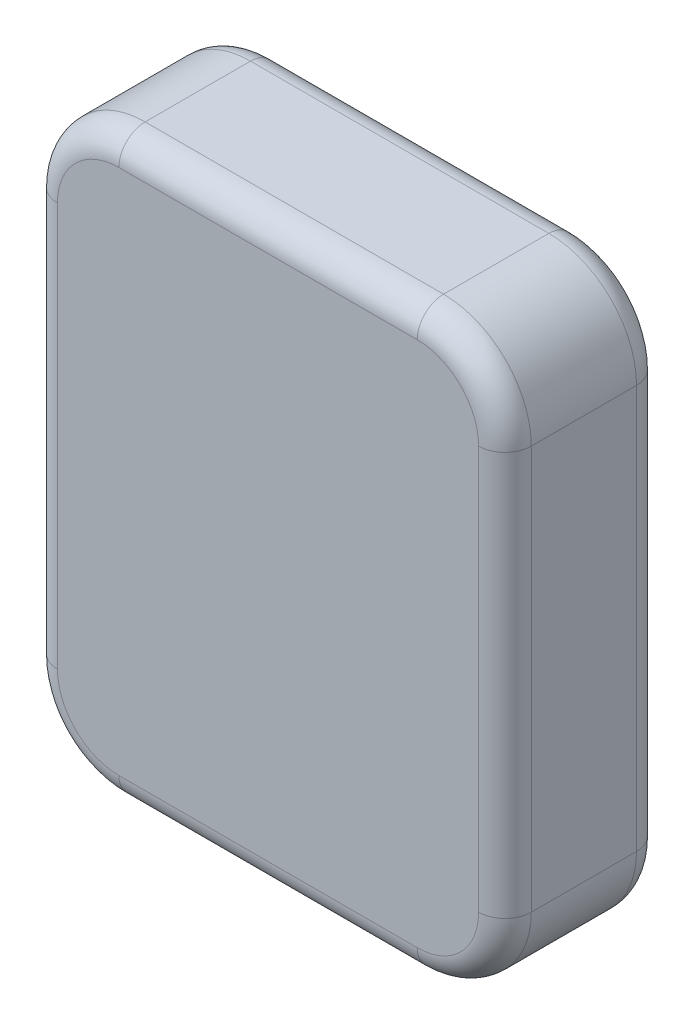
from build123d import *

# Parameters (mm, degrees)
SKETCH_1_W      = 54
SKETCH_1_H      = 66
EXTRUDE_1_DEPTH = 18
FILLET_1_R      = 10
FILLET_2_R      = 3


with BuildPart() as part:
    # 草图1 → 凸台-拉伸1 (new body)
    with BuildSketch(Plane.XY):
        with Locations((27, 33)):
            Rectangle(SKETCH_1_W, SKETCH_1_H)
    extrude(amount=EXTRUDE_1_DEPTH)

    # 圆角1
    fillet_1_edges = [part.edges().sort_by_distance(p)[0] for p in [
        (0, 66, 9),
        (54, 66, 9),
        (54, 0, 9),
        (0, 0, 9),
    ]]
    fillet(fillet_1_edges, radius=FILLET_1_R)

    # 圆角2
    fillet_2_edges = [part.edges().sort_by_distance(p)[0] for p in [
        (27, 0, 0),
        (27, 0, 18),
        (0, 33, 0),
        (27, 66, 0),
        (54, 33, 0),
        (2.928932188, 63.071067812, 0),
        (51.071067812, 63.071067812, 0),
        (51.071067812, 2.928932188, 0),
        (2.928932188, 2.928932188, 0),
        (0, 33, 18),
        (54, 33, 18),
        (27, 66, 18),
        (2.928932188, 63.071067812, 18),
        (51.071067812, 63.071067812, 18),
        (51.071067812, 2.928932188, 18),
        (2.928932188, 2.928932188, 18),
    ]]
    fillet(fillet_2_edges, radius=FILLET_2_R)


solid = part.part
